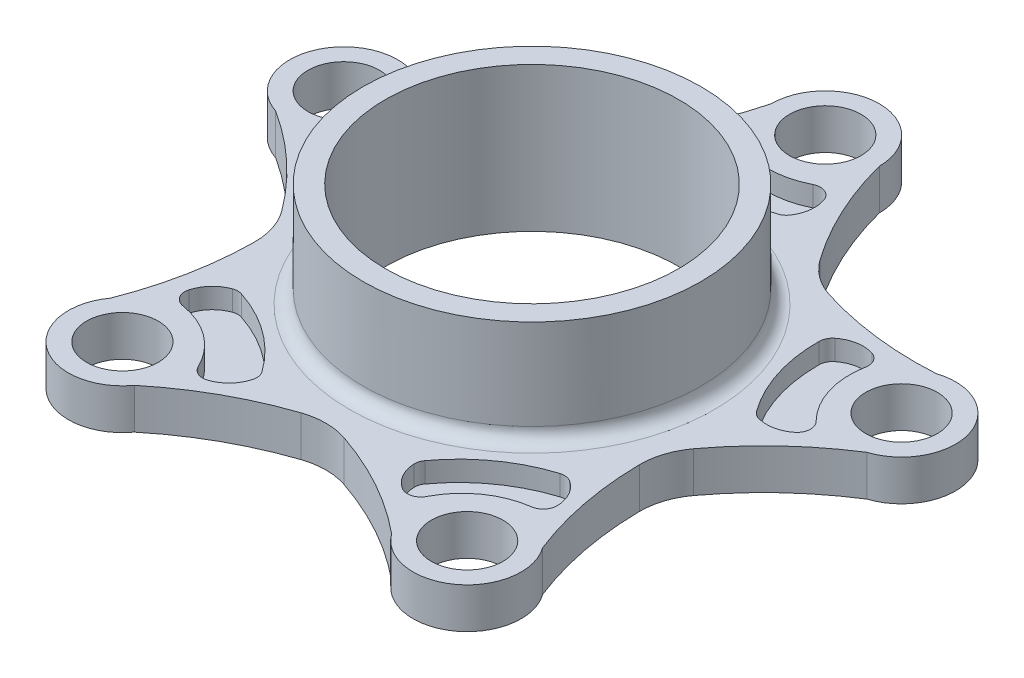
from build123d import *

# Parameters (mm, degrees)
SKETCH1_R                 = 31.75
CENTERCIRCLEEXTRUDE_DEPTH = 19.558
SKETCH2_R                 = 80.01
BASEEXPAND_DEPTH          = 7.62
SKETCH3_R                 = 27.559
CENTERCUT_DEPTH           = 27.178
SKETCH4_R                 = 6.731
OUTERCIRCLECUT_DEPTH      = 7.62
SKETCH8_R                 = 80.01
STARFISHCUT_DEPTH         = 7.62
FILLET8_R                 = 2.54
FILLET10_R                = 12.7
BATMAN_CUT_DEPTH          = 3.81
FILLET13_R                = 2.54


with BuildPart() as part:
    # Sketch1 → CenterCircleExtrude (new body)
    with BuildSketch(Plane(origin=(0, 0, 0), x_dir=(1, 0, 0), z_dir=(0, 1, 0))):
        Circle(SKETCH1_R)
    extrude(amount=CENTERCIRCLEEXTRUDE_DEPTH)

    # Sketch2 → BaseExpand (add)
    with BuildSketch(Plane.XZ):
        Circle(SKETCH2_R)
    extrude(amount=BASEEXPAND_DEPTH)

    # Sketch3 → CenterCut (cut)
    with BuildSketch(Plane(origin=(0, 19.558, 0), x_dir=(1, 0, 0), z_dir=(0, 1, 0))):
        Circle(SKETCH3_R)
    extrude(amount=-CENTERCUT_DEPTH, mode=Mode.SUBTRACT)

    # Sketch4 → OuterCircleCut (cut)
    with BuildSketch(Plane(origin=(0, 0, 0), x_dir=(1, 0, 0), z_dir=(0, 1, 0))):
        with Locations((0, 55.118)):
            Circle(SKETCH4_R)
        with Locations((52.420333065, 17.032398696)):
            Circle(SKETCH4_R)
        with Locations((32.397547536, -44.591398696)):
            Circle(SKETCH4_R)
        with Locations((-32.397547536, -44.591398696)):
            Circle(SKETCH4_R)
        with Locations((-52.420333065, 17.032398696)):
            Circle(SKETCH4_R)
    extrude(amount=-OUTERCIRCLECUT_DEPTH, mode=Mode.SUBTRACT)

    # Sketch8 → StarfishCut (cut)
    with BuildSketch(Plane(origin=(0, 0, 0), x_dir=(1, 0, 0), z_dir=(0, 1, 0))):
        Circle(SKETCH8_R)
        with BuildLine():
            ThreePointArc((-55.559945728, 7.36966449), (-62.083067271, 20.172011359), (-49.280720402, 26.695132902))
            ThreePointArc((-49.280720402, 26.695132902), (-35.631970511, 27.335423115), (-22.436174146, 30.88074446))
            ThreePointArc((-22.436174146, 30.88074446), (-14.986647849, 42.335128034), (-10.16, 55.118))
            ThreePointArc((-10.16, 55.118), (0, 65.278), (10.16, 55.118))
            ThreePointArc((10.16, 55.118), (14.986647849, 42.335128034), (22.436174146, 30.88074446))
            ThreePointArc((22.436174146, 30.88074446), (35.631970511, 27.335423115), (49.280720402, 26.695132902))
            ThreePointArc((49.280720402, 26.695132902), (58.392231228, 25.252011359), (62.580333065, 17.032398696))
            ThreePointArc((62.580333065, 17.032398696), (60.639945728, 11.060500533), (55.559945728, 7.36966449))
            ThreePointArc((55.559945728, 7.36966449), (44.894228259, -1.170875072), (36.302492346, -11.795394786))
            ThreePointArc((36.302492346, -11.795394786), (37.008416711, -25.440907452), (40.617160199, -38.619500533))
            ThreePointArc((40.617160199, -38.619500533), (42.060281741, -41.451786033), (42.557547536, -44.591398696))
            ThreePointArc((42.557547536, -44.591398696), (35.537160199, -54.254132902), (24.177934873, -50.563296859))
            ThreePointArc((24.177934873, -50.563296859), (12.759511114, -43.058768626), (0, -38.170699348))
            ThreePointArc((0, -38.170699348), (-12.759511114, -43.058768626), (-24.177934873, -50.563296859))
            ThreePointArc((-24.177934873, -50.563296859), (-38.369445699, -52.811011359), (-40.617160199, -38.619500533))
            ThreePointArc((-40.617160199, -38.619500533), (-37.008416711, -25.440907452), (-36.302492346, -11.795394786))
            ThreePointArc((-36.302492346, -11.795394786), (-44.894228259, -1.170875072), (-55.559945728, 7.36966449))
        make_face(mode=Mode.SUBTRACT)
    extrude(amount=-STARFISHCUT_DEPTH, mode=Mode.SUBTRACT)

    # Fillet8
    fillet8_edges = [part.edges().sort_by_distance(p)[0] for p in [
        (-31.75, 0, 0),
    ]]
    fillet(fillet8_edges, radius=FILLET8_R)

    # Fillet10
    fillet10_edges = [part.edges().sort_by_distance(p)[0] for p in [
        (-22.436174146, -3.81, -30.88074446),
        (-36.302492346, -3.81, 11.795394786),
        (0, -3.81, 38.170699348),
        (36.302492346, -3.81, 11.795394786),
        (22.436174146, -3.81, -30.88074446),
    ]]
    fillet(fillet10_edges, radius=FILLET10_R)

    # Sketch14 → Batman Cut (cut)
    with BuildSketch(Plane(origin=(0, 0, 0), x_dir=(1, 0, 0), z_dir=(0, 1, 0))):
        with BuildLine():
            ThreePointArc((-42.072446101, 13.670166407), (-41.327127702, 18.246593), (-41.992462929, 22.835330181))
            ThreePointArc((-41.992462929, 22.835330181), (-37.169801188, 23.437249916), (-33.334042842, 20.452734622))
            ThreePointArc((-33.334042842, 20.452734622), (-34.839316261, 10.472931285), (-39.677877094, 1.615694031))
            ThreePointArc((-39.677877094, 1.615694031), (-44.487558231, 2.31379216), (-47.394886457, 6.208380228))
            ThreePointArc((-47.394886457, 6.208380228), (-44.15942691, 9.529672356), (-42.072446101, 13.670166407))
        make_face()
        with BuildLine():
            ThreePointArc((8.74130489, 46.993710602), (10.804049012, 42.593090155), (9.150920809, 38.022801239))
            ThreePointArc((9.150920809, 38.022801239), (-0.805591254, 36.370472501), (-10.724521986, 38.235180477))
            ThreePointArc((-10.724521986, 38.235180477), (-11.54686442, 43.025183248), (-8.74130489, 46.993710602))
            ThreePointArc((-8.74130489, 46.993710602), (-4.582756384, 44.942941427), (0, 44.237587757))
            ThreePointArc((0, 44.237587757), (4.582756384, 44.942941427), (8.74130489, 46.993710602))
        make_face()
        with BuildLine():
            ThreePointArc((47.394886457, 6.208380228), (43.847070693, 2.886727486), (38.98962293, 3.046648891))
            ThreePointArc((38.98962293, 3.046648891), (34.341433485, 12.005256908), (33.049757994, 22.01494707))
            ThreePointArc((33.049757994, 22.01494707), (37.351203556, 24.277233459), (41.992462929, 22.835330181))
            ThreePointArc((41.992462929, 22.835330181), (41.327127702, 18.246593), (42.072446101, 13.670166407))
            ThreePointArc((42.072446101, 13.670166407), (44.15942691, 9.529672356), (47.394886457, 6.208380228))
        make_face()
        with BuildLine():
            ThreePointArc((20.550345833, -43.156720606), (16.294930984, -40.808994452), (14.945991371, -36.139868672))
            ThreePointArc((14.945991371, -36.139868672), (22.02976437, -28.950815688), (31.150395746, -24.629194927))
            ThreePointArc((31.150395746, -24.629194927), (34.631177738, -28.021027818), (34.694074251, -32.880700405))
            ThreePointArc((34.694074251, -32.880700405), (30.124325962, -33.665926774), (26.00220168, -35.788960285))
            ThreePointArc((26.00220168, -35.788960285), (22.709270369, -39.053280009), (20.550345833, -43.156720606))
        make_face()
        with BuildLine():
            ThreePointArc((-34.694074251, -32.880700405), (-33.776249501, -28.108073104), (-29.752492267, -25.38231608))
            ThreePointArc((-29.752492267, -25.38231608), (-20.72629034, -29.897845005), (-13.797754659, -37.23662665))
            ThreePointArc((-13.797754659, -37.23662665), (-15.947958643, -41.59518105), (-20.550345833, -43.156720606))
            ThreePointArc((-20.550345833, -43.156720606), (-22.709270369, -39.053280009), (-26.00220168, -35.788960285))
            ThreePointArc((-26.00220168, -35.788960285), (-30.124325962, -33.665926774), (-34.694074251, -32.880700405))
        make_face()
    extrude(amount=-BATMAN_CUT_DEPTH, mode=Mode.SUBTRACT)

    # Fillet13
    fillet13_edges = [part.edges().sort_by_distance(p)[0] for p in [
        (-13.797754659, -1.905, 37.23662665),
        (-29.752492267, -1.905, 25.38231608),
        (-20.550345833, -1.905, 43.156720606),
        (-34.694074251, -1.905, 32.880700405),
        (20.550345833, -1.905, 43.156720606),
        (34.694074251, -1.905, 32.880700405),
        (14.945991371, -1.905, 36.139868672),
        (31.150395746, -1.905, 24.629194927),
        (38.98962293, -1.905, -3.046648891),
        (33.049757994, -1.905, -22.01494707),
        (47.394886457, -1.905, -6.208380228),
        (41.992462929, -1.905, -22.835330181),
        (-10.724521986, -1.905, -38.235180477),
        (9.150920809, -1.905, -38.022801239),
        (8.74130489, -1.905, -46.993710602),
        (-8.74130489, -1.905, -46.993710602),
        (-47.394886457, -1.905, -6.208380228),
        (-41.992462929, -1.905, -22.835330181),
        (-33.334042842, -1.905, -20.452734622),
        (-39.677877094, -1.905, -1.615694031),
    ]]
    fillet(fillet13_edges, radius=FILLET13_R)


solid = part.part
